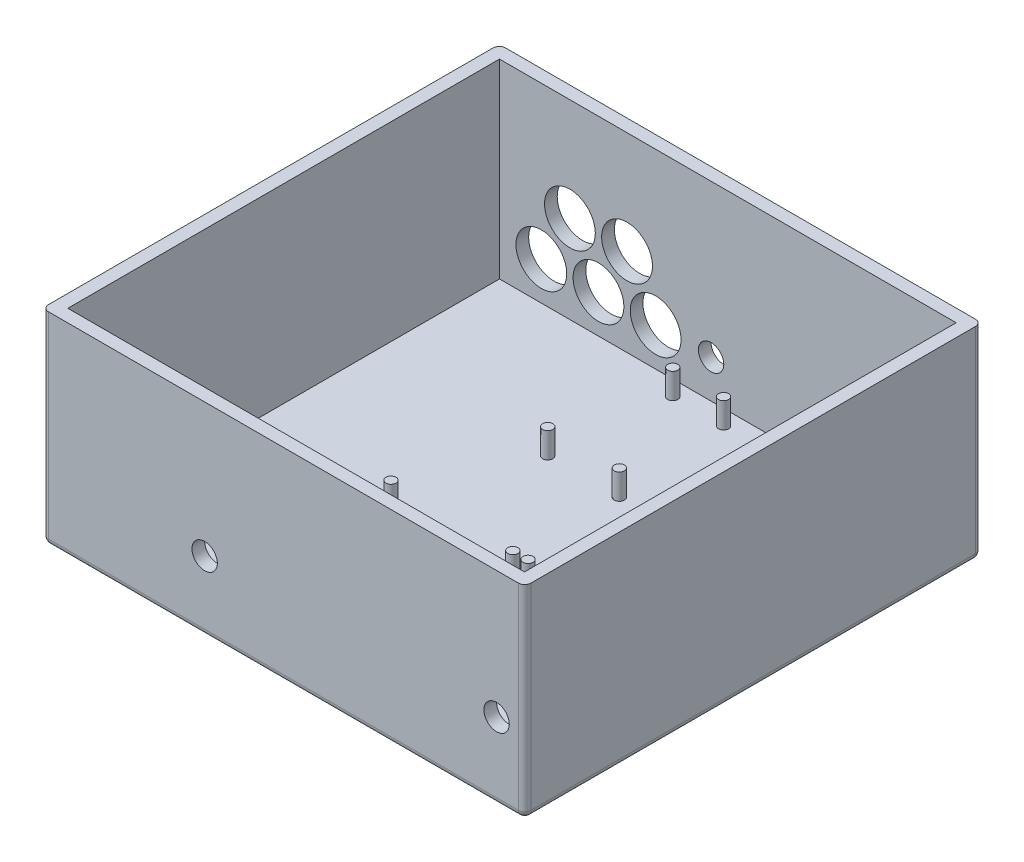
from build123d import *

# Parameters (mm, degrees)
SKETCH3_W            = 241.3
SKETCH3_H            = 228.6
BOSS_EXTRUDE2_DEPTH  = 101.6
SKETCH5_W            = 228.418653982
SKETCH5_H            = 215.9
CUT_EXTRUDE1_DEPTH   = 95.25
FILLET1_R            = 3.175
SKETCH18_R           = 6.35
SKETCH18_R_2         = 12.7
CUT_EXTRUDE5_DEPTH   = 8.89
SKETCH9_R            = 2.54
BOSS_EXTRUDE12_DEPTH = 12.7
SKETCH27_R           = 6.35
CUT_EXTRUDE6_DEPTH   = 8.89


with BuildPart() as part:
    # Sketch3 → Boss-Extrude2 (new body)
    with BuildSketch(Plane(origin=(0, 0, 0), x_dir=(1, 0, 0), z_dir=(0, 1, 0))):
        Rectangle(SKETCH3_W, SKETCH3_H)
    extrude(amount=BOSS_EXTRUDE2_DEPTH)

    # Sketch5 → Cut-Extrude1 (cut)
    with BuildSketch(Plane(origin=(0, 101.6, 0), x_dir=(1, 0, 0), z_dir=(0, 1, 0))):
        Rectangle(SKETCH5_W, SKETCH5_H)
    extrude(amount=-CUT_EXTRUDE1_DEPTH, mode=Mode.SUBTRACT)

    # Fillet1
    fillet1_edges = [part.edges().sort_by_distance(p)[0] for p in [
        (-120.65, 0, 0),
        (0, 0, -114.3),
        (120.65, 0, 0),
        (0, 0, 114.3),
        (-120.65, 50.8, 114.3),
        (-120.65, 50.8, -114.3),
        (120.65, 50.8, -114.3),
        (120.65, 50.8, 114.3),
    ]]
    fillet(fillet1_edges, radius=FILLET1_R)

    # Sketch18 → Cut-Extrude5 (cut)
    with BuildSketch(Plane.XY.offset(-107.95)):
        with Locations((-8.372170426, 25.4)):
            Circle(SKETCH18_R)
        with Locations((-36.121468176, 25.4)):
            Circle(SKETCH18_R_2)
        with Locations((-64.696468176, 25.4)):
            Circle(SKETCH18_R_2)
        with Locations((-93.271468176, 25.4)):
            Circle(SKETCH18_R_2)
        with Locations((-78.983968176, 50.146675913)):
            Circle(SKETCH18_R_2)
        with Locations((-50.408968176, 50.146675913)):
            Circle(SKETCH18_R_2)
    extrude(amount=-CUT_EXTRUDE5_DEPTH, mode=Mode.SUBTRACT)

    # Sketch9 → Boss-Extrude12 (add)
    with BuildSketch(Plane(origin=(0, 6.35, 0), x_dir=(1, 0, 0), z_dir=(0, 1, 0))):
        with Locations(Location((19.467326991, -19.05, 0), (0, 0, 270))):
            Circle(SKETCH9_R)
        with Locations(Location((27.087326991, -19.05, 0), (0, 0, 270))):
            Circle(SKETCH9_R)
        with Locations(Location((-41.492673009, -19.05, 0), (0, 0, 270))):
            Circle(SKETCH9_R)
        with Locations(Location((107.859326991, -19.05, 0), (0, 0, 270))):
            Circle(SKETCH9_R)
        with Locations(Location((107.859326991, 44.45, 0), (0, 0, 270))):
            Circle(SKETCH9_R)
        with Locations(Location((-107.859326991, -101.6, 0), (0, 0, 270))):
            Circle(SKETCH9_R)
        with Locations(Location((-60.234326991, -44.958, 0), (0, 0, 270))):
            Circle(SKETCH9_R)
        with Locations(Location((-107.859326991, -44.958, 0), (0, 0, 270))):
            Circle(SKETCH9_R)
        with Locations(Location((-60.234326991, -101.6, 0), (0, 0, 270))):
            Circle(SKETCH9_R)
        with Locations(Location((-25.512918077, 43.384129, 0), (0, 0, 270))):
            Circle(SKETCH9_R)
        with Locations(Location((-19.924918077, 100.33, 0), (0, 0, 270))):
            Circle(SKETCH9_R)
        with Locations(Location((10.301081923, 43.384129, 0), (0, 0, 270))):
            Circle(SKETCH9_R)
        with Locations(Location((5.475081923, 100.33, 0), (0, 0, 270))):
            Circle(SKETCH9_R)
    extrude(amount=BOSS_EXTRUDE12_DEPTH)

    # Sketch27 → Cut-Extrude6 (cut)
    with BuildSketch(Plane.XY.offset(114.3)):
        with Locations((-39.424308328, 34.84104297)):
            Circle(SKETCH27_R)
        with Locations((106.589326991, 38.1)):
            Circle(SKETCH27_R)
    extrude(amount=-CUT_EXTRUDE6_DEPTH, mode=Mode.SUBTRACT)


solid = part.part
